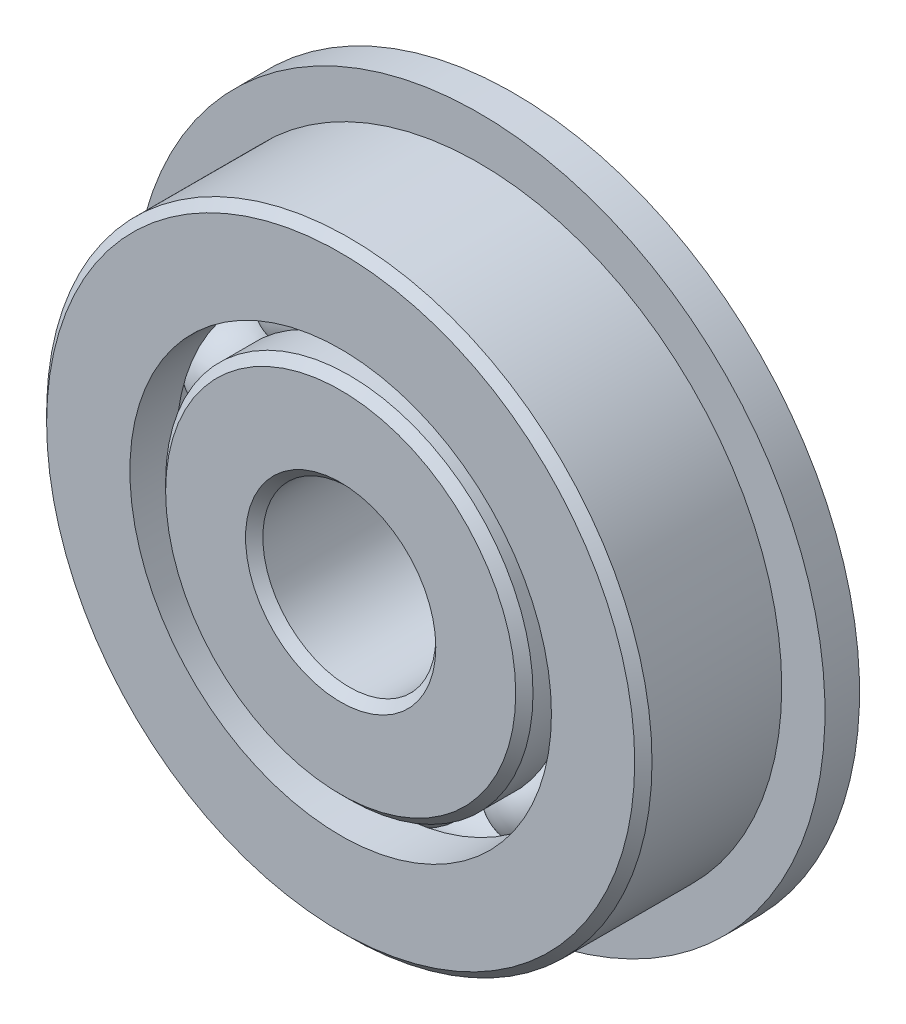
from build123d import *

# Parameters (mm, degrees)
SKETCH6_W         = 1.27
SKETCH6_H         = 4.962525
CIRPATTERN1_COUNT = 10


with BuildPart() as part:
    # Sketch1 → Revolve1 (revolve)
    with BuildSketch(Plane(origin=(0, 0, 0), x_dir=(0, 0, -1), z_dir=(1, 0, 0))):
        with BuildLine():
            Line((2.8575, 11.1125), (-2.8575, 11.1125))
            Line((-2.8575, 11.1125), (-3.175, 10.795))
            Line((-3.175, 10.795), (-3.175, 7.737475))
            Line((-3.175, 7.737475), (-1.472293067, 7.737475))
            ThreePointArc((-1.472293067, 7.737475), (0, 8.73125), (1.472293067, 7.737475))
            Line((1.472293067, 7.737475), (3.175, 7.737475))
            Line((3.175, 7.737475), (3.175, 10.795))
            Line((3.175, 10.795), (2.8575, 11.1125))
        make_face()
    revolve(axis=Axis((0, 0, 3.175), (0, 0, -1)))

    # Sketch6 → Revolve6 (revolve)
    with BuildSketch(Plane(origin=(0, 0, 0), x_dir=(0, 0, -1), z_dir=(1, 0, 0))):
        with Locations((2.54, 10.2187375)):
            Rectangle(SKETCH6_W, SKETCH6_H)
    revolve(axis=Axis((0, 0, -3.175), (0, 0, 1)))


with BuildPart() as body_2:
    # Sketch3 → Revolve3 (revolve)
    with BuildSketch(Plane(origin=(0, 0, 0), x_dir=(0, 0, -1), z_dir=(1, 0, 0))):
        with BuildLine():
            Line((-3.175, 3.4925), (-3.175, 6.4262))
            Line((-3.175, 6.4262), (-2.8575, 6.7437))
            Line((-2.8575, 6.7437), (-1.536266984, 6.7437))
            ThreePointArc((-1.536266984, 6.7437), (0, 5.55625), (1.536266984, 6.7437))
            Line((1.536266984, 6.7437), (4.4577, 6.7437))
            Line((4.4577, 6.7437), (4.7752, 6.4262))
            Line((4.7752, 6.4262), (4.7752, 3.4925))
            Line((4.7752, 3.4925), (4.4577, 3.175))
            Line((4.4577, 3.175), (-2.8575, 3.175))
            Line((-2.8575, 3.175), (-3.175, 3.4925))
        make_face()
    revolve(axis=Axis((0, 0, 3.175), (0, 0, -1)))


with BuildPart() as body_3:
    # Sketch4 → Revolve4 (revolve)
    with BuildSketch(Plane(origin=(0, 0, 0), x_dir=(0, 0, -1), z_dir=(1, 0, 0))):
        with BuildLine():
            Line((-1.5875, 7.14375), (1.5875, 7.14375))
            ThreePointArc((1.5875, 7.14375), (0, 8.73125), (-1.5875, 7.14375))
        make_face()
    revolve(axis=Axis((0, 7.14375, 1.5875), (0, 0, -1)))


with BuildPart() as cirpattern1_1:
    # CirPattern1: pattern copy
    add(body_3.part.rotate(Axis((0, 0, -3.175), (0, 0, 1)), 1 * 360 / CIRPATTERN1_COUNT))


with BuildPart() as cirpattern1_2:
    # CirPattern1: pattern copy
    add(body_3.part.rotate(Axis((0, 0, -3.175), (0, 0, 1)), 2 * 360 / CIRPATTERN1_COUNT))


with BuildPart() as cirpattern1_3:
    # CirPattern1: pattern copy
    add(body_3.part.rotate(Axis((0, 0, -3.175), (0, 0, 1)), 3 * 360 / CIRPATTERN1_COUNT))


with BuildPart() as cirpattern1_4:
    # CirPattern1: pattern copy
    add(body_3.part.rotate(Axis((0, 0, -3.175), (0, 0, 1)), 4 * 360 / CIRPATTERN1_COUNT))


with BuildPart() as cirpattern1_5:
    # CirPattern1: pattern copy
    add(body_3.part.rotate(Axis((0, 0, -3.175), (0, 0, 1)), 5 * 360 / CIRPATTERN1_COUNT))


with BuildPart() as cirpattern1_6:
    # CirPattern1: pattern copy
    add(body_3.part.rotate(Axis((0, 0, -3.175), (0, 0, 1)), 6 * 360 / CIRPATTERN1_COUNT))


with BuildPart() as cirpattern1_7:
    # CirPattern1: pattern copy
    add(body_3.part.rotate(Axis((0, 0, -3.175), (0, 0, 1)), 7 * 360 / CIRPATTERN1_COUNT))


with BuildPart() as cirpattern1_8:
    # CirPattern1: pattern copy
    add(body_3.part.rotate(Axis((0, 0, -3.175), (0, 0, 1)), 8 * 360 / CIRPATTERN1_COUNT))


with BuildPart() as cirpattern1_9:
    # CirPattern1: pattern copy
    add(body_3.part.rotate(Axis((0, 0, -3.175), (0, 0, 1)), 9 * 360 / CIRPATTERN1_COUNT))


solid = Compound([part.part, body_2.part, body_3.part, cirpattern1_1.part, cirpattern1_2.part, cirpattern1_3.part, cirpattern1_4.part, cirpattern1_5.part, cirpattern1_6.part, cirpattern1_7.part, cirpattern1_8.part, cirpattern1_9.part])
